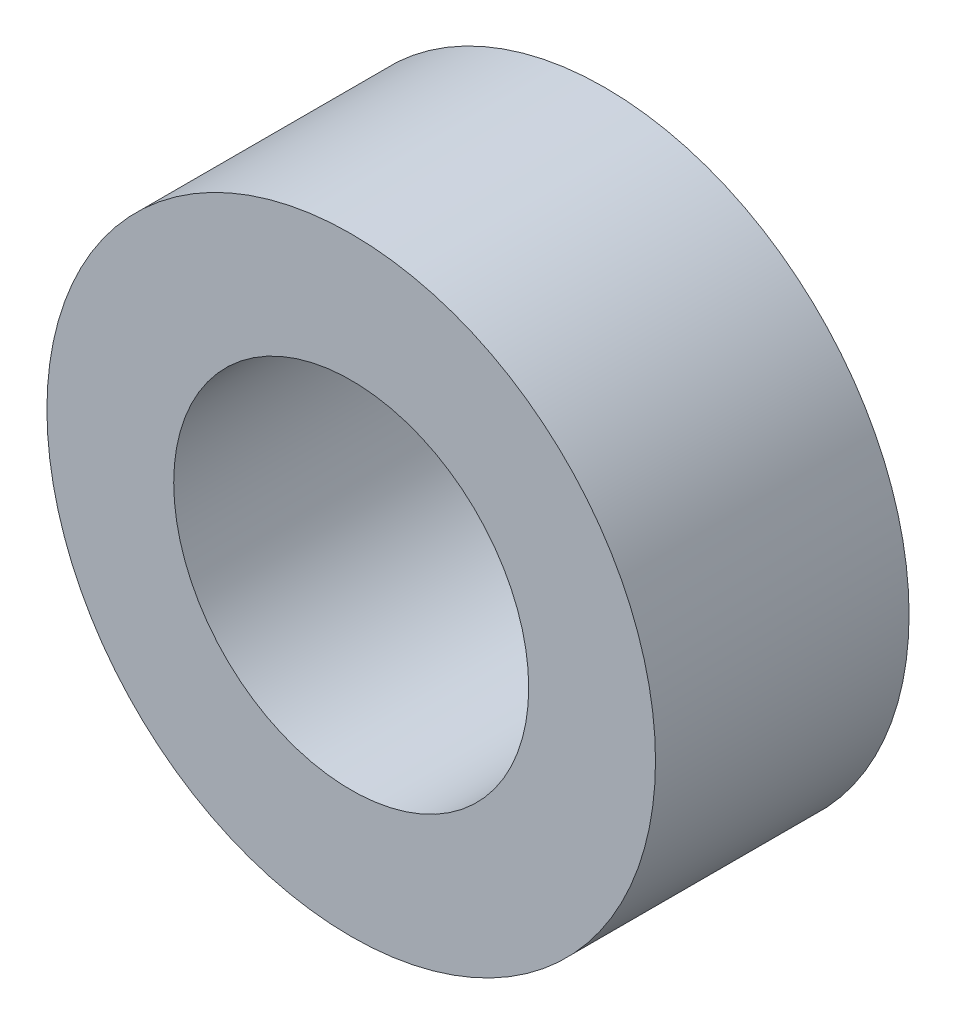
from build123d import *

# Parameters (mm, degrees)
SKETCH1_R           = 6
SKETCH1_R_2         = 3.5
BOSS_EXTRUDE1_DEPTH = 5


with BuildPart() as part:
    # Sketch1 → Boss-Extrude1 (new body)
    with BuildSketch(Plane.XY.offset(5)):
        Circle(SKETCH1_R)
        Circle(SKETCH1_R_2, mode=Mode.SUBTRACT)
    extrude(amount=-BOSS_EXTRUDE1_DEPTH)


solid = part.part
